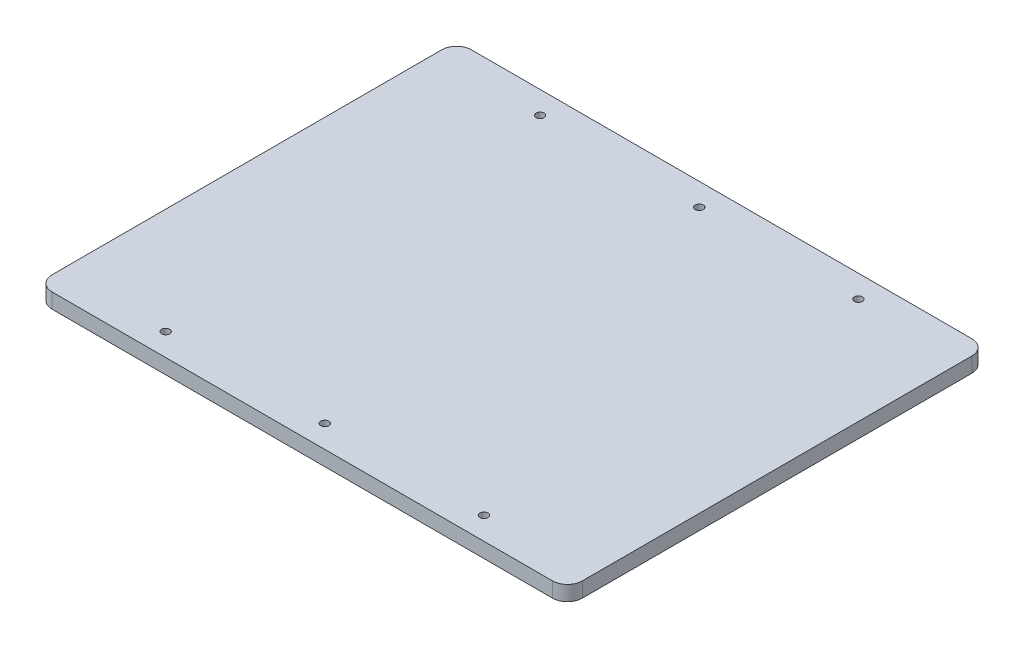
from build123d import *

# Parameters (mm, degrees)
SKETCH1_R           = 1.7
BOSS_EXTRUDE1_DEPTH = 6.35


with BuildPart() as part:
    # Sketch1 → Boss-Extrude1 (new body)
    with BuildSketch(Plane(origin=(0, 0, 0), x_dir=(1, 0, 0), z_dir=(0, 1, 0))):
        with BuildLine():
            Line((-106.045, 88.9), (106.045, 88.9))
            ThreePointArc((106.045, 88.9), (110.535128061, 87.040128061), (112.395, 82.55))
            Line((112.395, 82.55), (112.395, -82.55))
            ThreePointArc((112.395, -82.55), (110.535128061, -87.040128061), (106.045, -88.9))
            Line((106.045, -88.9), (-106.045, -88.9))
            ThreePointArc((-106.045, -88.9), (-110.535128061, -87.040128061), (-112.395, -82.55))
            Line((-112.395, -82.55), (-112.395, 82.55))
            ThreePointArc((-112.395, 82.55), (-110.535128061, 87.040128061), (-106.045, 88.9))
        make_face()
        with Locations(Location((-67.47002, 79.375, 0), (0, 0, 270))):
            Circle(SKETCH1_R, mode=Mode.SUBTRACT)
        with Locations(Location((0, 79.375, 0), (0, 0, 270))):
            Circle(SKETCH1_R, mode=Mode.SUBTRACT)
        with Locations(Location((67.46875, 79.375, 0), (0, 0, 270))):
            Circle(SKETCH1_R, mode=Mode.SUBTRACT)
        with Locations(Location((67.46875, -79.375, 0), (0, 0, 90))):
            Circle(SKETCH1_R, mode=Mode.SUBTRACT)
        with Locations(Location((0, -79.375, 0), (0, 0, 90))):
            Circle(SKETCH1_R, mode=Mode.SUBTRACT)
        with Locations(Location((-67.47002, -79.375, 0), (0, 0, 90))):
            Circle(SKETCH1_R, mode=Mode.SUBTRACT)
    extrude(amount=BOSS_EXTRUDE1_DEPTH)


solid = part.part
